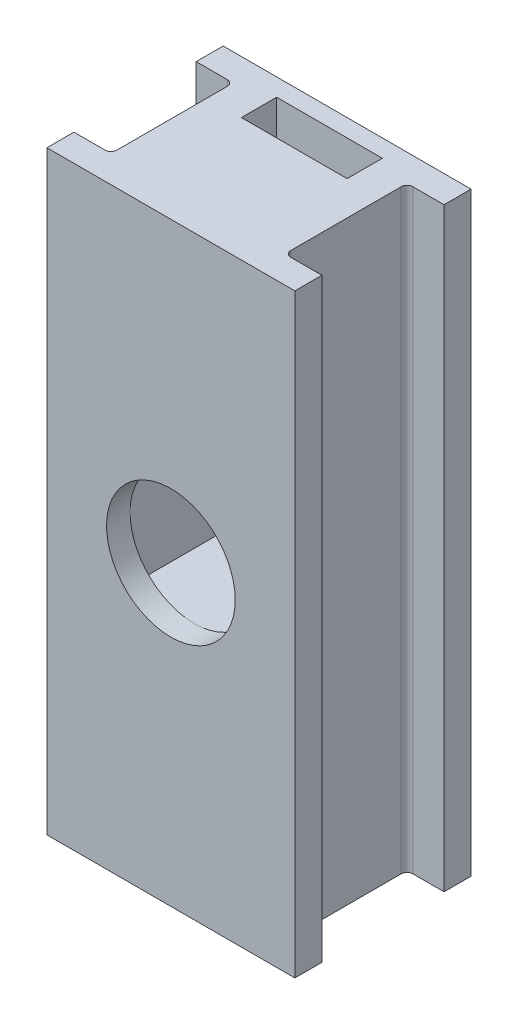
from build123d import *

# Parameters (mm, degrees)
SKETCH2_W           = 21.1
SKETCH2_H           = 50.65
SKETCH2_R           = 5.475
BOSS_EXTRUDE1_DEPTH = 7.5
SKETCH3_W           = 3.15
SKETCH3_H           = 10.4
CUT_EXTRUDE1_DEPTH  = 53.277863384
FILLET1_R           = 0.5
SKETCH4_W           = 11.1
SKETCH4_H           = 21
CUT_EXTRUDE3_DEPTH  = 13
SKETCH6_W           = 11.1
SKETCH6_H           = 18.940672382
CUT_EXTRUDE4_DEPTH  = 13
SKETCH7_W           = 11.1
SKETCH7_H           = 5
CUT_EXTRUDE5_DEPTH  = 1
SKETCH8_W           = 9
SKETCH8_H           = 3
CUT_EXTRUDE6_DEPTH  = 9.8


with BuildPart() as part:
    # Sketch2 → Boss-Extrude1 (new, symmetric)
    with BuildSketch(Plane.XY):
        with Locations((0, 6.8)):
            Rectangle(SKETCH2_W, SKETCH2_H)
        with Locations((0, 6.8)):
            Circle(SKETCH2_R, mode=Mode.SUBTRACT)
    extrude(amount=BOSS_EXTRUDE1_DEPTH, both=True)

    # Sketch3 → Cut-Extrude1 (cut, symmetric)
    with BuildSketch(Plane(origin=(0, 32.125, 0), x_dir=(1, 0, 0), z_dir=(0, 1, 0))):
        with Locations((-8.975, 0)):
            Rectangle(SKETCH3_W, SKETCH3_H)
    cut_extrude1 = extrude(amount=CUT_EXTRUDE1_DEPTH, both=True, mode=Mode.SUBTRACT)

    # Mirror1: Cut-Extrude1 across plane
    add(cut_extrude1.mirror(Plane(origin=(0, 0, 0), x_dir=(0, 0, 1), z_dir=(1, 0, 0))), mode=Mode.SUBTRACT)

    # Fillet1
    fillet1_edges = [part.edges().sort_by_distance(p)[0] for p in [
        (-7.4, 6.8, -5.2),
        (-7.4, 6.8, 5.2),
        (7.4, 6.8, 5.2),
        (7.4, 6.8, -5.2),
    ]]
    fillet(fillet1_edges, radius=FILLET1_R)

    # Sketch4 → Cut-Extrude3 (cut)
    with BuildSketch(Plane(origin=(0, 0, -7.5), x_dir=(-1, 0, 0), z_dir=(0, 0, -1))):
        with Locations((0, 11.825)):
            Rectangle(SKETCH4_W, SKETCH4_H)
    extrude(amount=-CUT_EXTRUDE3_DEPTH, mode=Mode.SUBTRACT)

    # Sketch6 → Cut-Extrude4 (cut)
    with BuildSketch(Plane(origin=(0, 0, -7.5), x_dir=(-1, 0, 0), z_dir=(0, 0, -1))):
        with Locations((0, -10.645336191)):
            Rectangle(SKETCH6_W, SKETCH6_H)
    extrude(amount=-CUT_EXTRUDE4_DEPTH, mode=Mode.SUBTRACT)

    # Sketch7 → Cut-Extrude5 (cut)
    with BuildSketch(Plane(origin=(0, 0, 5.5), x_dir=(-1, 0, 0), z_dir=(0, 0, -1))):
        with Locations((0, 19.825)):
            Rectangle(SKETCH7_W, SKETCH7_H)
    extrude(amount=-CUT_EXTRUDE5_DEPTH, mode=Mode.SUBTRACT)

    # Sketch8 → Cut-Extrude6 (cut)
    with BuildSketch(Plane(origin=(0, 32.125, 0), x_dir=(1, 0, 0), z_dir=(0, 1, 0))):
        with Locations((0, 4.5)):
            Rectangle(SKETCH8_W, SKETCH8_H)
    extrude(amount=-CUT_EXTRUDE6_DEPTH, mode=Mode.SUBTRACT)


solid = part.part
